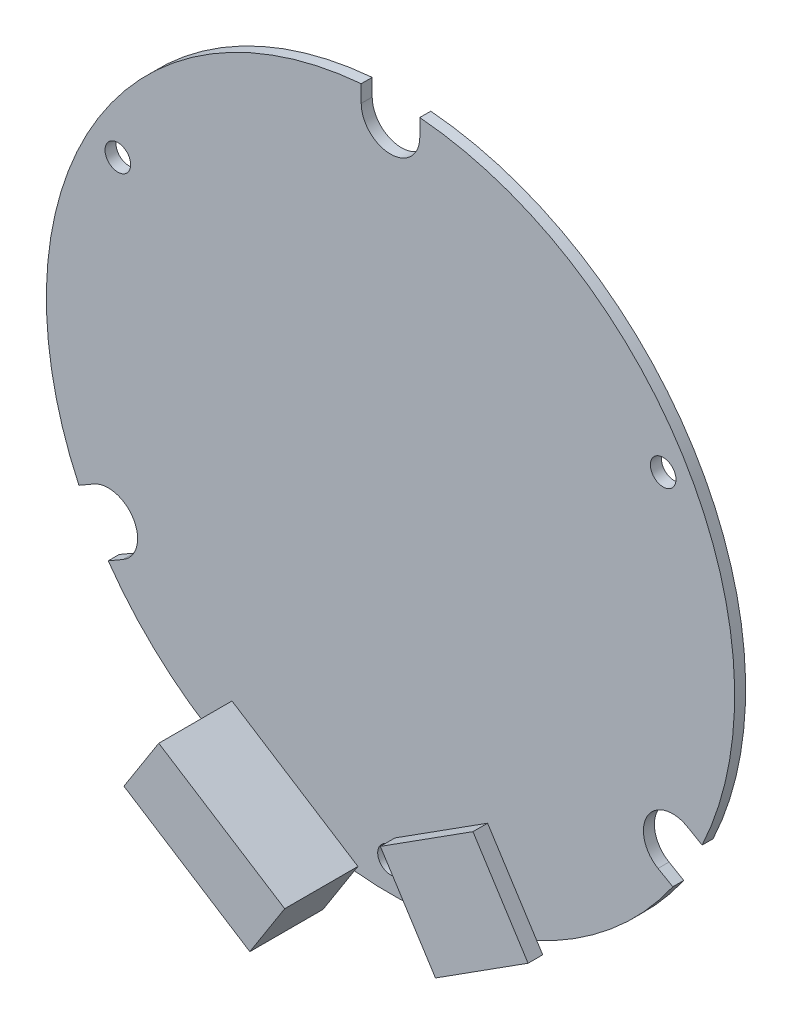
from build123d import *

# Parameters (mm, degrees)
SALIENTE_EXTRUIR1_DEPTH = 1.5
CROQUIS2_R              = 1.75
CORTAR_EXTRUIR1_DEPTH   = 1.5
SALIENTE_EXTRUIR2_START = 2
SALIENTE_EXTRUIR2_DEPTH = 2
SALIENTE_EXTRUIR3_DEPTH = 10


with BuildPart() as part:
    # Croquis1 → Saliente-Extruir1 (new body)
    with BuildSketch(Plane.XY):
        with BuildLine():
            Line((-4, 44.5), (-4, 46.829477896))
            ThreePointArc((-4, 46.829477896), (-40.703193978, 23.5), (-42.555517504, -19.950637333))
            Line((-42.555517504, -19.950637333), (-40.538130468, -18.785898385))
            ThreePointArc((-40.538130468, -18.785898385), (-35.074028853, -20.25), (-36.538130468, -25.714101615))
            Line((-36.538130468, -25.714101615), (-38.555517504, -26.878840563))
            ThreePointArc((-38.555517504, -26.878840563), (0, -47), (38.555517504, -26.878840563))
            Line((38.555517504, -26.878840563), (36.538130468, -25.714101615))
            ThreePointArc((36.538130468, -25.714101615), (35.074028853, -20.25), (40.538130468, -18.785898385))
            Line((40.538130468, -18.785898385), (42.555517504, -19.950637333))
            ThreePointArc((42.555517504, -19.950637333), (40.703193978, 23.5), (4, 46.829477896))
            Line((4, 46.829477896), (4, 44.5))
            ThreePointArc((4, 44.5), (0, 40.5), (-4, 44.5))
        make_face()
    extrude(amount=SALIENTE_EXTRUIR1_DEPTH)

    # Croquis2 → Cortar-Extruir1 (cut)
    with BuildSketch(Plane.XY.offset(1.5)):
        with Locations((-37.239092363, 21.5)):
            Circle(CROQUIS2_R)
        with Locations((37.239092363, 21.5)):
            Circle(CROQUIS2_R)
        with Locations((0, -43)):
            Circle(CROQUIS2_R)
    extrude(amount=-CORTAR_EXTRUIR1_DEPTH, mode=Mode.SUBTRACT)

    # Croquis4 → Saliente-Extruir3 (add)
    with BuildSketch(Plane.XY.offset(1.5)):
        Polygon((-26.409104031, -42.465035702), (-9.210425901, -53.436155545), (-4.450895969, -45.974964298), (-21.649574099, -35.003844455), align=None)
    extrude(amount=SALIENTE_EXTRUIR3_DEPTH)


with BuildPart() as body_2:
    # Croquis3 → Saliente-Extruir2 (new body)
    with BuildSketch(Plane.XY.offset(1.5).offset(SALIENTE_EXTRUIR2_START)):
        Polygon((15.259137072, -30.005171494), (22.78751294, -41.808711505), (10.140862928, -49.874828506), (2.61248706, -38.071288495), align=None)
    extrude(amount=SALIENTE_EXTRUIR2_DEPTH)


solid = Compound([part.part, body_2.part])
